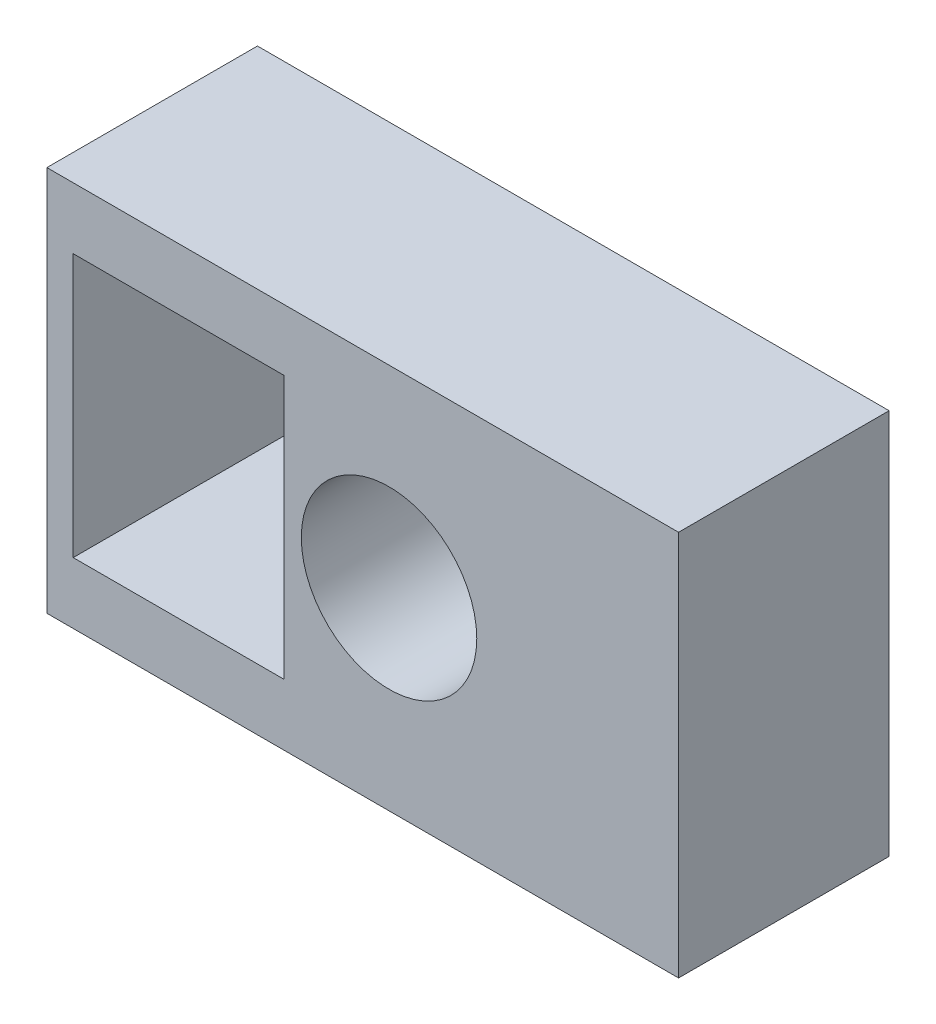
from build123d import *

# Parameters (mm, degrees)
SKETCH_1_W      = 13
SKETCH_1_H      = 11
SKETCH_1_R      = 2.5
SKETCH_1_W_2    = 6
SKETCH_1_H_2    = 7.5
EXTRUDE_1_DEPTH = 6
SKETCH_2_W      = 6
SKETCH_2_H      = 11
EXTRUDE_2_DEPTH = 5


with BuildPart() as part:
    # 草图1 → 凸台-拉伸1 (new body)
    with BuildSketch(Plane.XY):
        with Locations((5.75, 3.75)):
            Rectangle(SKETCH_1_W, SKETCH_1_H)
        with Locations((9, 3.75)):
            Circle(SKETCH_1_R, mode=Mode.SUBTRACT)
        with Locations((3, 3.75)):
            Rectangle(SKETCH_1_W_2, SKETCH_1_H_2, mode=Mode.SUBTRACT)
    extrude(amount=EXTRUDE_1_DEPTH)

    # 草图2 → 凸台-拉伸2 (add)
    with BuildSketch(Plane(origin=(12.25, 0, 0), x_dir=(0, 0, -1), z_dir=(1, 0, 0))):
        with Locations((-3, 3.75)):
            Rectangle(SKETCH_2_W, SKETCH_2_H)
    extrude(amount=EXTRUDE_2_DEPTH)


solid = part.part
